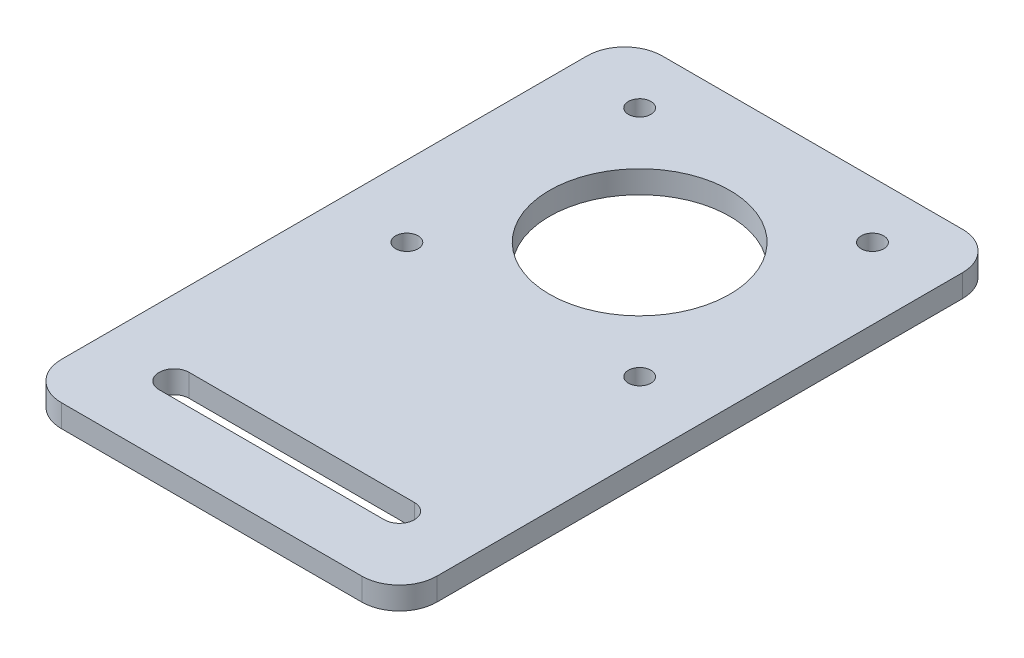
from build123d import *

# Parameters (mm, degrees)
SKETCH1_W           = 50
SKETCH1_H           = 80
BOSS_EXTRUDE1_DEPTH = 3
SKETCH2_R           = 1.5
SKETCH2_R_2         = 12
CUT_EXTRUDE1_DEPTH  = 48.265209192
FILLET1_R           = 5


with BuildPart() as part:
    # Sketch1 → Boss-Extrude1 (new body)
    with BuildSketch(Plane(origin=(0, 0, 0), x_dir=(1, 0, 0), z_dir=(0, 1, 0))):
        Rectangle(SKETCH1_W, SKETCH1_H)
    extrude(amount=BOSS_EXTRUDE1_DEPTH)

    # Sketch2 → Cut-Extrude1 (cut, through all)
    with BuildSketch(Plane(origin=(0, 3, 0), x_dir=(1, 0, 0), z_dir=(0, 1, 0))):
        with Locations(Location((15.5, 32.5, 0), (0, 0, 270))):
            Circle(SKETCH2_R)
        with Locations(Location((-15.5, 32.5, 0), (0, 0, 270))):
            Circle(SKETCH2_R)
        with Locations(Location((-15.5, 1.5, 0), (0, 0, 270))):
            Circle(SKETCH2_R)
        with Locations(Location((15.5, 1.5, 0), (0, 0, 270))):
            Circle(SKETCH2_R)
        with Locations(Location((0, 17, 0), (0, 0, 270))):
            Circle(SKETCH2_R_2)
        with BuildLine():
            Line((-15, -28), (15, -28))
            ThreePointArc((15, -28), (17, -30), (15, -32))
            Line((15, -32), (-15, -32))
            ThreePointArc((-15, -32), (-17, -30), (-15, -28))
        make_face()
    extrude(amount=-CUT_EXTRUDE1_DEPTH, mode=Mode.SUBTRACT)

    # Fillet1
    fillet1_edges = [part.edges().sort_by_distance(p)[0] for p in [
        (-25, 1.5, -40),
        (25, 1.5, -40),
        (25, 1.5, 40),
        (-25, 1.5, 40),
    ]]
    fillet(fillet1_edges, radius=FILLET1_R)


solid = part.part
